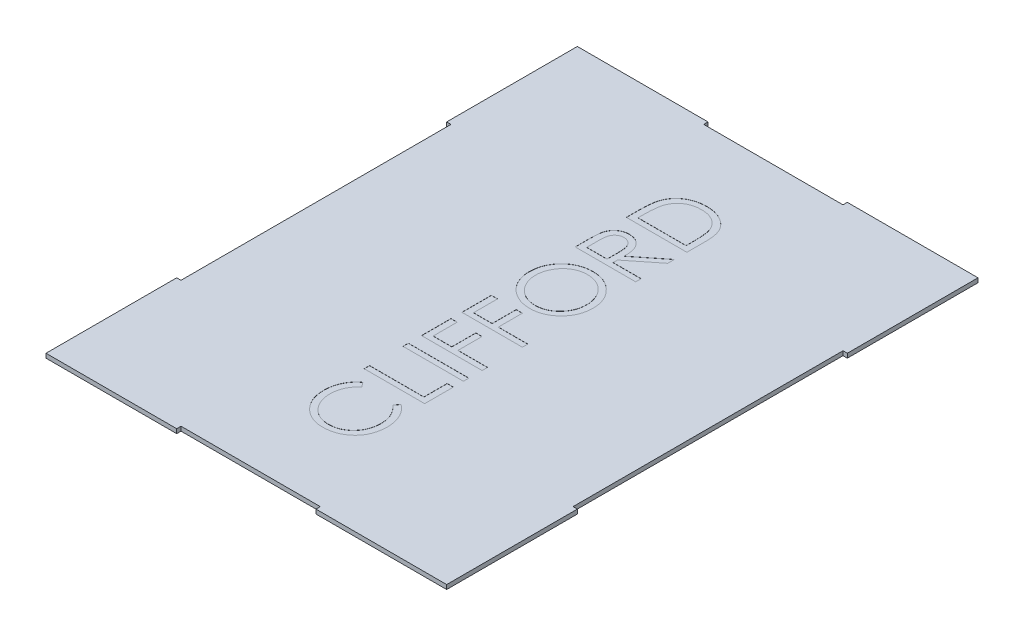
from build123d import *

# Parameters (mm, degrees)
SALIENTE_EXTRUIR1_DEPTH = 3.3
CROQUIS2_W              = 46.302083333
CROQUIS2_H              = 4.155315171
CORTAR_EXTRUIR1_DEPTH   = 0.1


with BuildPart() as part:
    # Croquis1 → Saliente-Extruir1 (new body)
    with BuildSketch(Plane(origin=(0, 0, 0), x_dir=(1, 0, 0), z_dir=(0, 1, 0))):
        Polygon((53.3, 200), (-53.3, 200), (-53.3, 203.3), (-153.3, 203.3), (-153.3, 103.3), (-150, 103.3), (-150, -103.3), (-153.3, -103.3), (-153.3, -200), (-153.3, -203.3), (-53.3, -203.3), (-53.3, -200), (53.3, -200), (53.3, -203.3), (153.3, -203.3), (153.3, -200), (153.3, -103.3), (150, -103.3), (150, 103.3), (153.3, 103.3), (153.3, 203.3), (150, 203.3), (53.3, 203.3), align=None)
    extrude(amount=SALIENTE_EXTRUIR1_DEPTH)

    # Croquis2 → Cortar-Extruir1 (cut)
    # profile 1 of 8: a face of its own
    with BuildSketch(Plane(origin=(0, 3.3, 0), x_dir=(1, 0, 0), z_dir=(0, 1, 0))):
        with BuildLine():
            Line((-12.80594785, -101.323450855), (-10.023370726, -104.959351629))
            add(Edge.make_bspline(
                [(-10.023370726, -104.959351629), (-10.332478946, -105.218723854), (-10.946527937, -105.733971403), (-11.808859078, -106.562861358), (-12.616476844, -107.426893854), (-13.374570292, -108.324866699), (-14.052670074, -109.277561062), (-14.703587169, -110.248676606), (-15.273487484, -111.273498261), (-15.969692012, -112.683434577), (-16.68034091, -114.53506359), (-17.291560308, -116.857904729), (-17.676981206, -119.286062955), (-17.719008061, -120.942259554), (-17.740384615, -121.784667969)],
                knots=[0, 0, 0, 0, 0.75789156, 1.505565099, 2.245254514, 2.979266606, 3.711207489, 4.440978832, 5.174393176, 5.91211879, 7.394186119, 8.890401545, 10.418332761, 12, 12, 12, 12], degree=3))
            add(Edge.make_bspline(
                [(-17.740384615, -121.784667969), (-17.735040528, -122.248790783), (-17.724401951, -123.172728914), (-17.584052066, -124.543911844), (-17.386789184, -125.889490751), (-17.094089592, -127.208590352), (-16.724035164, -128.49953159), (-16.28184475, -129.770753935), (-15.73475484, -131.00385271), (-15.130072049, -132.215884842), (-14.447086204, -133.377133651), (-13.702099422, -134.475871862), (-12.903495978, -135.508156436), (-12.048107772, -136.47456855), (-11.140430132, -137.376962968), (-10.170294074, -138.203984379), (-9.14807065, -138.966682421), (-8.072910959, -139.660710324), (-6.954828454, -140.28549661), (-5.787439557, -140.810844724), (-4.590732324, -141.269680213), (-3.356222947, -141.638464887), (-2.092116619, -141.928096781), (-0.793176499, -142.128334943), (0.538134693, -142.267058274), (1.440485494, -142.277648089), (1.895334619, -142.282986111)],
                knots=[0, 0, 0, 0, 1.054877232, 2.099964208, 3.13098259, 4.145888998, 5.169474743, 6.183358035, 7.203388855, 8.234598956, 9.261847606, 10.264062591, 11.251197969, 12.227332808, 13.196685059, 14.158975844, 15.123498106, 16.094582253, 17.066912473, 18.032714859, 19.002806091, 19.979168736, 20.95977404, 21.949109834, 22.966205168, 24, 24, 24, 24], degree=3))
            add(Edge.make_bspline(
                [(1.895334619, -142.282986111), (2.579681616, -142.266254155), (3.923306171, -142.23340318), (5.89163394, -141.942277734), (7.779103417, -141.496330588), (9.572934722, -140.838919835), (11.288081611, -140.012121507), (12.903744416, -138.980505171), (14.443593071, -137.781190666), (15.870333336, -136.401874561), (17.173569401, -134.888340929), (18.321212186, -133.264498957), (19.277876527, -131.53432901), (20.0739545, -129.716951429), (20.685892365, -127.79837659), (21.116688608, -125.782055823), (21.397704948, -123.672374204), (21.424608947, -122.230799853), (21.438301282, -121.497134999)],
                knots=[0, 0, 0, 0, 1.029159485, 2.020618137, 2.987588728, 3.942669054, 4.889339625, 5.846988364, 6.821327795, 7.821533711, 8.827683044, 9.822769455, 10.807800696, 11.797391277, 12.803701919, 13.832062008, 14.896664671, 16, 16, 16, 16], degree=3))
            add(Edge.make_bspline(
                [(21.438301282, -121.497134999), (21.415960133, -120.688797343), (21.371987408, -119.097795464), (20.999464008, -116.764593449), (20.395447803, -114.531036966), (19.550131539, -112.397005874), (18.451247002, -110.368516283), (17.119097998, -108.442393798), (15.541012763, -106.617012605), (14.336058879, -105.519371684), (13.721287393, -104.959351629)],
                knots=[0, 0, 0, 0, 1.028121516, 2.023589091, 2.998037872, 3.967518031, 4.937445131, 5.927275754, 6.942489185, 8, 8, 8, 8], degree=3))
            Line((13.721287393, -104.959351629), (16.476038745, -101.323450855))
            add(Edge.make_bspline(
                [(16.476038745, -101.323450855), (16.853565617, -101.616065276), (17.606811028, -102.199892513), (18.668932637, -103.145070362), (19.667064197, -104.141494722), (20.596221078, -105.19172681), (21.460249201, -106.297617722), (22.259617924, -107.45906598), (22.990084988, -108.675080178), (23.661054848, -109.936001657), (24.251821063, -111.244735954), (24.775326231, -112.589761716), (25.208730681, -113.979325863), (25.575342216, -115.401731329), (25.836752739, -116.869824464), (26.044919597, -118.366539772), (26.1684196, -119.905885986), (26.180905547, -120.943493056), (26.187232906, -121.469309228)],
                knots=[0, 0, 0, 0, 0.986911346, 1.969095443, 2.935967484, 3.900112155, 4.865124501, 5.834589912, 6.812044781, 7.795288262, 8.784678562, 9.777857908, 10.776141921, 11.791195789, 12.811324908, 13.855933174, 14.913475973, 16, 16, 16, 16], degree=3))
            add(Edge.make_bspline(
                [(26.187232906, -121.469309228), (26.183766963, -121.967303574), (26.176913489, -122.952025724), (26.065892108, -124.405894625), (25.91442163, -125.821277621), (25.686349063, -127.194129443), (25.417210398, -128.531941821), (25.056434398, -129.822587053), (24.652294382, -131.078765357), (24.177301328, -132.295429864), (23.641305997, -133.473615476), (23.035521832, -134.609522147), (22.365042998, -135.702627451), (21.644648589, -136.763678331), (20.851198866, -137.777000532), (19.995713181, -138.751375294), (19.081074913, -139.692266386), (18.421536749, -140.274385239), (18.089933477, -140.567063552)],
                knots=[0, 0, 0, 0, 1.114604814, 2.203992996, 3.262667896, 4.300477797, 5.318619304, 6.316056647, 7.298880507, 8.271930387, 9.238335007, 10.195173496, 11.151986948, 12.108099108, 13.064862484, 14.031167946, 15.010108607, 16, 16, 16, 16], degree=3))
            add(Edge.make_bspline(
                [(18.089933477, -140.567063552), (17.513907949, -141.035817009), (16.368811178, -141.967664721), (14.51311951, -143.160402597), (12.577345444, -144.17797572), (10.550276643, -145.009905325), (8.431125087, -145.648924318), (6.223299873, -146.09819621), (3.931214559, -146.388110675), (2.372354013, -146.421386819), (1.579975878, -146.438301282)],
                knots=[0, 0, 0, 0, 0.994611881, 1.977215934, 2.950189954, 3.921972279, 4.908960509, 5.911694611, 6.938501887, 8, 8, 8, 8], degree=3))
            add(Edge.make_bspline(
                [(1.579975878, -146.438301282), (0.747127691, -146.417727367), (-0.891449124, -146.377249474), (-3.296167048, -146.033346763), (-5.600044928, -145.480118939), (-7.798781966, -144.6943476), (-9.903942965, -143.698120557), (-11.899446404, -142.467455978), (-13.798054066, -141.016651076), (-15.570957547, -139.357084295), (-17.192051066, -137.537183088), (-18.618237303, -135.588277946), (-19.805125275, -133.514183439), (-20.797262007, -131.33774936), (-21.559850217, -129.042678364), (-22.09368925, -126.633867127), (-22.425967767, -124.1158419), (-22.467973122, -122.397870227), (-22.489316239, -121.524960771)],
                knots=[0, 0, 0, 0, 1.032925535, 2.032216505, 3.007276963, 3.968222605, 4.92396291, 5.891752235, 6.871517503, 7.883894988, 8.900124299, 9.891468569, 10.874487609, 11.85992873, 12.854644235, 13.869047385, 14.917252991, 16, 16, 16, 16], degree=3))
            add(Edge.make_bspline(
                [(-22.489316239, -121.524960771), (-22.482932406, -120.992958564), (-22.470296251, -119.939913772), (-22.34726415, -118.382119014), (-22.141736462, -116.865589557), (-21.863465469, -115.388730463), (-21.513039295, -113.947272028), (-21.076296033, -112.543910989), (-20.556322491, -111.18208382), (-19.962536807, -109.862232935), (-19.294828202, -108.593268055), (-18.561072499, -107.375985815), (-17.764977168, -106.215239191), (-16.898392, -105.117061247), (-15.968505216, -104.080108383), (-14.986209148, -103.088998363), (-13.926297321, -102.172581446), (-13.180081295, -101.607012513), (-12.80594785, -101.323450855)],
                knots=[0, 0, 0, 0, 1.096622143, 2.170653093, 3.219033441, 4.250379162, 5.267604342, 6.275621678, 7.278284436, 8.271072515, 9.257558938, 10.232633088, 11.19973724, 12.157384997, 13.114417402, 14.069920322, 15.032307892, 16, 16, 16, 16], degree=3))
        make_face()
    # profile 2 of 8: a face of its own
    with BuildSketch(Plane(origin=(0, 3.3, 0), x_dir=(1, 0, 0), z_dir=(0, 1, 0))):
        Polygon((-21.302083333, -91.825587607), (-21.302083333, -87.670272436), (20.251068376, -87.670272436), (20.251068376, -69.861778846), (25, -69.861778846), (25, -91.825587607), align=None)
    # profile 3 of 8: a face of its own
    with BuildSketch(Plane(origin=(0, 3.3, 0), x_dir=(1, 0, 0), z_dir=(0, 1, 0))):
        with Locations((1.848958333, -60.067107372)):
            Rectangle(CROQUIS2_W, CROQUIS2_H)
    # profile 4 of 8: a face of its own
    with BuildSketch(Plane(origin=(0, 3.3, 0), x_dir=(1, 0, 0), z_dir=(0, 1, 0))):
        Polygon((-21.302083333, -47.897970085), (-21.302083333, -25.340544872), (-16.553151709, -25.340544872), (-16.553151709, -43.742654915), (-2.306356838, -43.742654915), (-2.306356838, -25.340544872), (2.442574786, -25.340544872), (2.442574786, -43.742654915), (25, -43.742654915), (25, -47.897970085), align=None)
    # profile 5 of 8: a face of its own
    with BuildSketch(Plane(origin=(0, 3.3, 0), x_dir=(1, 0, 0), z_dir=(0, 1, 0))):
        Polygon((-21.302083333, -17.02991453), (-21.302083333, 5.527510684), (-16.553151709, 5.527510684), (-16.553151709, -12.874599359), (-2.306356838, -12.874599359), (-2.306356838, 5.527510684), (2.442574786, 5.527510684), (2.442574786, -12.874599359), (25, -12.874599359), (25, -17.02991453), align=None)
    # profile 6 of 8: a face of its own
    with BuildSketch(Plane(origin=(0, 3.3, 0), x_dir=(1, 0, 0), z_dir=(0, 1, 0))):
        with BuildLine():
            add(Edge.make_bspline(
                [(-22.489316239, 35.50514156), (-22.467966404, 36.362592273), (-22.426033565, 38.046696217), (-22.094447326, 40.519512186), (-21.548691071, 42.887344353), (-20.777966709, 45.151553961), (-19.778819418, 47.303529659), (-18.5651416, 49.349349194), (-17.129557497, 51.28288145), (-15.493147293, 53.090817146), (-13.701011053, 54.740073345), (-11.78249522, 56.187304223), (-9.7617206, 57.408180044), (-7.638581793, 58.407599876), (-5.418035739, 59.192210682), (-3.087637417, 59.733497461), (-0.662650221, 60.079293807), (0.991352051, 60.119717764), (1.830407819, 60.140224359)],
                knots=[0, 0, 0, 0, 1.065064174, 2.09187391, 3.093564831, 4.079973196, 5.057907931, 6.036227367, 7.030399151, 8.044883615, 9.061699972, 10.052012555, 11.025713132, 11.989727027, 12.962874294, 13.945865945, 14.957962116, 16, 16, 16, 16], degree=3))
            add(Edge.make_bspline(
                [(1.830407819, 60.140224359), (2.663278052, 60.119710863), (4.30496177, 60.079276385), (6.714629649, 59.733216882), (9.030706399, 59.189795434), (11.248029776, 58.417314427), (13.366856404, 57.417127682), (15.389160817, 56.194454549), (17.312801012, 54.749970352), (19.117283609, 53.107717739), (20.767967392, 51.312167456), (22.223934784, 49.401025033), (23.445342068, 47.380304294), (24.455919519, 45.270945883), (25.224179152, 43.056386444), (25.783497531, 40.752741362), (26.125861093, 38.347459622), (26.166551152, 36.708960527), (26.187232906, 35.876151843)],
                knots=[0, 0, 0, 0, 1.043748596, 2.057349401, 3.045489418, 4.02252776, 4.995289225, 5.97782527, 6.980224157, 8.006516136, 9.032559198, 10.034193337, 11.013412982, 11.987833483, 12.961212594, 13.946489799, 14.956251404, 16, 16, 16, 16], degree=3))
            add(Edge.make_bspline(
                [(26.187232906, 35.876151843), (26.166735809, 35.037100956), (26.126330575, 33.383108308), (25.779972407, 30.955066278), (25.238353076, 28.623058625), (24.464321992, 26.393754187), (23.463969044, 24.265909806), (22.244181946, 22.23536392), (20.796816641, 20.310266868), (19.154196331, 18.50657918), (17.365989341, 16.856251246), (15.449952842, 15.417455338), (13.44367753, 14.197393943), (11.3415957, 13.200399857), (9.153869323, 12.41108878), (6.86590509, 11.872597957), (4.490747044, 11.524195258), (2.873575368, 11.484046768), (2.053013989, 11.463675214)],
                knots=[0, 0, 0, 0, 1.053102029, 2.075944431, 3.073151272, 4.055350789, 5.033113405, 6.020478099, 7.024410459, 8.052272461, 9.079885166, 10.07527673, 11.055994387, 12.023226415, 12.992069828, 13.970394897, 14.97016774, 16, 16, 16, 16], degree=3))
            add(Edge.make_bspline(
                [(2.053013989, 11.463675214), (1.50224847, 11.470747996), (0.407665586, 11.484804334), (-1.217757145, 11.654027766), (-2.817039805, 11.899583604), (-4.385634637, 12.251504739), (-5.919701831, 12.7117695), (-7.429821297, 13.254853613), (-8.900689309, 13.918161984), (-10.339273762, 14.667999723), (-11.723149183, 15.504900725), (-13.031243669, 16.429298661), (-14.274533939, 17.408724889), (-15.420801594, 18.482448951), (-16.503392673, 19.615083174), (-17.505670284, 20.825001301), (-18.436672239, 22.104820576), (-19.275670501, 23.460047891), (-20.034484053, 24.857289653), (-20.685648123, 26.297638692), (-21.244528312, 27.761532919), (-21.697505895, 29.255828783), (-22.055117205, 30.776558163), (-22.298631155, 32.327040105), (-22.468286193, 33.90603939), (-22.482276064, 34.96981413), (-22.489316239, 35.50514156)],
                knots=[0, 0, 0, 0, 1.037015668, 2.060948919, 3.074880161, 4.083647147, 5.086022904, 6.090072063, 7.104153813, 8.122640571, 9.144368836, 10.147691507, 11.138137339, 12.123020368, 13.103399296, 14.087645067, 15.080126199, 16.082011238, 17.087798457, 18.072939717, 19.057185487, 20.037253025, 21.01195951, 21.997135196, 22.992090687, 24, 24, 24, 24], degree=3))
        make_face()
        with BuildLine():
            add(Edge.make_bspline(
                [(-17.740384615, 35.709197216), (-17.735046935, 35.269789674), (-17.724422604, 34.395175356), (-17.583709331, 33.095035924), (-17.384593485, 31.81160065), (-17.095407453, 30.547353152), (-16.721357885, 29.299642066), (-16.270224582, 28.067913459), (-15.724962379, 26.856390522), (-15.11174878, 25.666586788), (-14.415236228, 24.525982825), (-13.675607927, 23.431831735), (-12.865382676, 22.412593309), (-12.002082836, 21.454266067), (-11.078216295, 20.559233271), (-10.099850197, 19.727889715), (-9.062752843, 18.96091713), (-7.971192326, 18.267545699), (-6.831263072, 17.650499251), (-5.664755611, 17.098031696), (-4.457961053, 16.640057173), (-3.218410163, 16.277273117), (-1.951565367, 15.969352579), (-0.650524434, 15.776202028), (0.680227483, 15.634102293), (1.579575885, 15.624066472), (2.034463475, 15.618990385)],
                knots=[0, 0, 0, 0, 1.008406545, 2.007172654, 2.999155034, 3.989332444, 4.982025741, 5.988181096, 6.998684226, 8.030553839, 9.059268815, 10.065399129, 11.060956322, 12.046057109, 13.024974577, 14.012068307, 14.991706172, 15.984221787, 16.978487447, 17.966117052, 18.945677757, 19.938371053, 20.93015022, 21.936155317, 22.956113857, 24, 24, 24, 24], degree=3))
            add(Edge.make_bspline(
                [(2.034463475, 15.618990385), (2.703344313, 15.635894333), (4.019239847, 15.669149629), (5.947847896, 15.959079435), (7.803126395, 16.409224099), (9.574017164, 17.061848833), (11.268417082, 17.894400459), (12.879732162, 18.909944422), (14.407487084, 20.117780965), (15.840309237, 21.488970238), (17.147582147, 22.988329566), (18.296681901, 24.579665421), (19.263796305, 26.250387745), (20.072282213, 27.99086693), (20.681361858, 29.815962879), (21.115635364, 31.713973788), (21.397100367, 33.684941604), (21.424437311, 35.028041942), (21.438301282, 35.709197216)],
                knots=[0, 0, 0, 0, 1.032022337, 2.030307203, 3.003823408, 3.974715386, 4.937372378, 5.913284036, 6.909147208, 7.938749767, 8.970518239, 9.975863271, 10.963918693, 11.946286286, 12.933361397, 13.927862637, 14.949112547, 16, 16, 16, 16], degree=3))
            add(Edge.make_bspline(
                [(21.438301282, 35.709197216), (21.432015831, 36.167053882), (21.419549893, 37.075121166), (21.293815941, 38.425733444), (21.092590114, 39.752138668), (20.801435276, 41.051886093), (20.441861958, 42.326678673), (19.995848314, 43.572669904), (19.461184858, 44.78944594), (18.865320127, 45.982989944), (18.188433853, 47.126577307), (17.458776421, 48.214091523), (16.662847301, 49.23157396), (15.811141941, 50.189451569), (14.890115359, 51.078211698), (13.917695153, 51.907188249), (12.878396674, 52.660899664), (11.791306929, 53.351920549), (10.659688448, 53.976495907), (9.489974009, 54.512983184), (8.288437181, 54.97115442), (7.054195169, 55.34049234), (5.79002429, 55.63005466), (4.49411525, 55.829539689), (3.169092047, 55.969089375), (2.272897091, 55.979607226), (1.821132562, 55.984909188)],
                knots=[0, 0, 0, 0, 1.047334373, 2.07717862, 3.100662057, 4.115010574, 5.122652213, 6.129548646, 7.140165612, 8.16200981, 9.179904151, 10.178566626, 11.156366481, 12.133321541, 13.108841334, 14.082538371, 15.054589433, 16.043660176, 17.028268541, 18.009491307, 18.985652105, 19.968123554, 20.954864208, 21.950389976, 22.966808393, 24, 24, 24, 24], degree=3))
            add(Edge.make_bspline(
                [(1.821132562, 55.984909188), (1.372458704, 55.979602798), (0.482431456, 55.969076595), (-0.833352286, 55.829608441), (-2.119931231, 55.629836246), (-3.372254453, 55.341933751), (-4.59064121, 54.970853605), (-5.77394707, 54.513291997), (-6.926580761, 53.973736661), (-8.045691772, 53.354502149), (-9.119569796, 52.6584413), (-10.146170629, 51.897830546), (-11.106301326, 51.059596472), (-12.023340311, 50.167469174), (-12.878944907, 49.199999969), (-13.669809201, 48.157020021), (-14.4315669, 47.064498169), (-15.105730901, 45.897727837), (-15.731437353, 44.697898402), (-16.265260992, 43.465606263), (-16.723739894, 42.218450359), (-17.096524068, 40.951444329), (-17.383485763, 39.665187056), (-17.58388752, 38.360426554), (-17.724374275, 37.041717178), (-17.7350309, 36.154780049), (-17.740384615, 35.709197216)],
                knots=[0, 0, 0, 0, 1.029877221, 2.042951179, 3.035109885, 4.018542222, 4.991021277, 5.957494829, 6.929429462, 7.911425532, 8.892163142, 9.866273635, 10.842761649, 11.81676864, 12.802607151, 13.805177466, 14.821356543, 15.858816981, 16.897175917, 17.927346774, 18.940346092, 19.946830556, 20.957962087, 21.964146003, 22.97721996, 24, 24, 24, 24], degree=3))
        make_face(mode=Mode.SUBTRACT)
    # profile 7 of 8: a face of its own
    with BuildSketch(Plane(origin=(0, 3.3, 0), x_dir=(1, 0, 0), z_dir=(0, 1, 0))):
        with BuildLine():
            Line((-21.302083333, 69.638087607), (-21.302083333, 78.904069428))
            add(Edge.make_bspline(
                [(-21.302083333, 78.904069428), (-21.30002506, 79.522415607), (-21.296072948, 80.709708767), (-21.274036293, 82.41062599), (-21.210875546, 83.956151127), (-21.15652241, 85.345476085), (-21.05741027, 86.578575375), (-20.962680876, 87.659230159), (-20.838675155, 88.58246324), (-20.723509664, 89.141340648), (-20.671365852, 89.394385183)],
                knots=[0, 0, 0, 0, 1.410062039, 2.707475311, 3.878576406, 4.937260626, 5.877586885, 6.699081471, 7.410979367, 8, 8, 8, 8], degree=3))
            add(Edge.make_bspline(
                [(-20.671365852, 89.394385183), (-20.587667793, 89.733139218), (-20.422057182, 90.403420745), (-20.072021983, 91.368493148), (-19.666937801, 92.288095628), (-19.191211738, 93.15849158), (-18.641048703, 93.975013772), (-18.026925804, 94.747231161), (-17.350083432, 95.472637095), (-16.604420077, 96.141764449), (-15.80582318, 96.749567026), (-14.956484522, 97.282703504), (-14.059915938, 97.733194025), (-13.114720957, 98.086713454), (-12.131340684, 98.3833551), (-11.099738241, 98.582661742), (-10.023357437, 98.706810307), (-9.290973188, 98.719074965), (-8.919615134, 98.725293803)],
                knots=[0, 0, 0, 0, 1.02737844, 2.032840108, 3.019645024, 3.985760442, 4.950801802, 5.916702504, 6.889791722, 7.870143693, 8.864820395, 9.842884691, 10.820524757, 11.815201459, 12.812418953, 13.84314332, 14.906358105, 16, 16, 16, 16], degree=3))
            add(Edge.make_bspline(
                [(-8.919615134, 98.725293803), (-8.302671563, 98.705860183), (-7.098854863, 98.667940155), (-5.351799452, 98.314389304), (-3.722107477, 97.735262429), (-2.211830913, 96.937235584), (-0.850408834, 95.920977937), (0.345381564, 94.699597888), (1.346034575, 93.272414069), (2.03994147, 91.943817911), (2.484347657, 90.770202977), (2.797036988, 89.80403311), (3.03862757, 88.750105387), (3.25505848, 87.618517731), (3.418461104, 86.404561039), (3.53814001, 85.111144893), (3.612938363, 83.737346845), (3.624077386, 82.793590407), (3.629807692, 82.308088775)],
                knots=[0, 0, 0, 0, 1.260483769, 2.459530307, 3.627416485, 4.787058657, 5.939039949, 7.08810263, 8.267026773, 9.491475466, 10.141966685, 10.831826277, 11.566392101, 12.351337768, 13.187381173, 14.07005841, 15.007169909, 16, 16, 16, 16], degree=3))
            Line((3.629807692, 82.308088775), (25, 99.318910256))
            Line((25, 99.318910256), (25, 94.180417835))
            Line((25, 94.180417835), (3.629807692, 77.169596354))
            Line((3.629807692, 77.169596354), (3.629807692, 73.793402778))
            Line((3.629807692, 73.793402778), (25, 73.793402778))
            Line((25, 73.793402778), (25, 69.638087607))
            Line((25, 69.638087607), (-21.302083333, 69.638087607))
        make_face()
        with BuildLine():
            Line((-16.553151709, 73.793402778), (-1.119123932, 73.793402778))
            Line((-1.119123932, 73.793402778), (-1.054197132, 82.270987747))
            add(Edge.make_bspline(
                [(-1.054197132, 82.270987747), (-1.05402192, 82.66680498), (-1.05368231, 83.434011513), (-1.106518019, 84.543946693), (-1.166617644, 85.577413046), (-1.258567344, 86.530444237), (-1.37699729, 87.403510286), (-1.525371142, 88.196029879), (-1.697492568, 88.909769526), (-1.966656834, 89.7395005), (-2.374475381, 90.67697719), (-3.007890852, 91.673535), (-3.768986137, 92.547934524), (-4.664420888, 93.260067995), (-5.633308577, 93.856719822), (-6.68557242, 94.258242771), (-7.787078002, 94.52584077), (-8.543898122, 94.555096384), (-8.928890391, 94.569978632)],
                knots=[0, 0, 0, 0, 1.146477201, 2.22219935, 3.21835465, 4.145220026, 4.995151787, 5.769831222, 6.480173269, 7.120302478, 8.295254187, 9.430763426, 10.528629691, 11.636497428, 12.733230534, 13.811001502, 14.886462612, 16, 16, 16, 16], degree=3))
            add(Edge.make_bspline(
                [(-8.928890391, 94.569978632), (-9.301215745, 94.554029672), (-10.039028736, 94.522424653), (-11.119713503, 94.265806571), (-12.139980224, 93.827092296), (-13.101146211, 93.249961721), (-13.960000972, 92.525660386), (-14.702828592, 91.692692105), (-15.31093527, 90.751217177), (-15.715104994, 89.879031281), (-15.952456047, 89.09320924), (-16.124970231, 88.414168877), (-16.244701507, 87.643145562), (-16.358108853, 86.783645673), (-16.449915162, 85.8340289), (-16.513241904, 84.791512007), (-16.550328892, 83.662553047), (-16.552188873, 82.880091972), (-16.553151709, 82.475043403)],
                knots=[0, 0, 0, 0, 1.100823979, 2.181431445, 3.263702604, 4.376021382, 5.48638238, 6.575013887, 7.666064109, 8.791843368, 9.405226397, 10.093019944, 10.863016055, 11.711746407, 12.658404307, 13.684961631, 14.801597923, 16, 16, 16, 16], degree=3))
            Line((-16.553151709, 82.475043403), (-16.553151709, 73.793402778))
        make_face(mode=Mode.SUBTRACT)
    # profile 8 of 8: a face of its own
    with BuildSketch(Plane(origin=(0, 3.3, 0), x_dir=(1, 0, 0), z_dir=(0, 1, 0))):
        with BuildLine():
            Line((25, 108.816773504), (-21.302083333, 108.816773504))
            Line((-21.302083333, 108.816773504), (-21.302083333, 118.166232639))
            add(Edge.make_bspline(
                [(-21.302083333, 118.166232639), (-21.296228501, 118.979416129), (-21.284916996, 120.550482399), (-21.213196509, 122.820772068), (-21.086322638, 124.921348926), (-20.901517448, 126.845304458), (-20.674597107, 128.597920491), (-20.390164675, 130.174289578), (-20.054300338, 131.582562718), (-19.767949069, 132.448668859), (-19.632537059, 132.85823985)],
                knots=[0, 0, 0, 0, 1.314313732, 2.53924729, 3.670748893, 4.714932338, 5.66265055, 6.526160246, 7.303039223, 8, 8, 8, 8], degree=3))
            add(Edge.make_bspline(
                [(-19.632537059, 132.85823985), (-19.428465254, 133.393999753), (-19.024949313, 134.453370301), (-18.262604549, 135.960889122), (-17.402382625, 137.38488579), (-16.424487444, 138.714006935), (-15.34168868, 139.951587475), (-14.161721829, 141.111673577), (-12.858374438, 142.165663304), (-11.454845318, 143.129972555), (-9.969117628, 143.999657133), (-8.403624607, 144.755545289), (-6.766424806, 145.38332623), (-5.06204181, 145.904464652), (-3.286735936, 146.315183728), (-1.438437812, 146.595402945), (0.475547269, 146.780227523), (1.774313616, 146.798801949), (2.433299529, 146.808226496)],
                knots=[0, 0, 0, 0, 0.984741985, 1.947153288, 2.898543998, 3.841229145, 4.778974371, 5.722123648, 6.681464302, 7.655713756, 8.646344578, 9.637374342, 10.639946623, 11.656849581, 12.698333139, 13.76849723, 14.867749466, 16, 16, 16, 16], degree=3))
            add(Edge.make_bspline(
                [(2.433299529, 146.808226496), (3.005609658, 146.799905774), (4.133406543, 146.783508922), (5.795530966, 146.63627744), (7.408345647, 146.422277869), (8.964172045, 146.090965224), (10.476635496, 145.688760869), (11.929637751, 145.173313884), (13.33642938, 144.582763836), (14.678275874, 143.894406606), (15.948732894, 143.137677059), (17.147263237, 142.330647701), (18.247271115, 141.455015728), (19.277581721, 140.536697195), (20.210671469, 139.55354698), (21.063549331, 138.517534794), (21.821936283, 137.424634413), (22.497749642, 136.268080475), (23.102110834, 135.032426909), (23.606220576, 133.678806157), (24.042831078, 132.213630047), (24.390154755, 130.62854305), (24.670273789, 128.92919869), (24.856778122, 127.110882938), (24.983263289, 125.177032168), (24.994312771, 123.849093549), (25, 123.165596204)],
                knots=[0, 0, 0, 0, 1.106010661, 2.179509527, 3.223302912, 4.248870533, 5.252098245, 6.246278179, 7.226402005, 8.199283979, 9.158616973, 10.083547221, 10.989831858, 11.874256832, 12.749262829, 13.607058236, 14.46581075, 15.317568432, 16.194266721, 17.121067875, 18.106207572, 19.147242834, 20.255495536, 21.43354536, 22.679031616, 24, 24, 24, 24], degree=3))
            Line((25, 123.165596204), (25, 108.816773504))
        make_face()
        with BuildLine():
            Line((20.251068376, 112.972088675), (20.251068376, 118.286810981))
            add(Edge.make_bspline(
                [(20.251068376, 118.286810981), (20.247786268, 119.050509219), (20.241473572, 120.519380614), (20.186080363, 122.63152287), (20.095567232, 124.561385719), (19.968896932, 126.309243187), (19.80130171, 127.874108405), (19.614441017, 129.259251763), (19.381641408, 130.460132784), (19.170623508, 131.18680346), (19.073110727, 131.522602831)],
                knots=[0, 0, 0, 0, 1.375205317, 2.645023457, 3.804390687, 4.853969522, 5.800190428, 6.637939096, 7.370582563, 8, 8, 8, 8], degree=3))
            add(Edge.make_bspline(
                [(19.073110727, 131.522602831), (18.924262016, 131.945253082), (18.630119841, 132.78045859), (18.093575381, 133.982738979), (17.458020312, 135.10400586), (16.751547319, 136.163786175), (15.949271448, 137.147097848), (15.068516889, 138.065401026), (14.105259684, 138.917571435), (13.061061793, 139.690483345), (11.947246288, 140.390563654), (10.761843296, 140.991553234), (9.521517798, 141.514936425), (8.216228651, 141.92936113), (6.855542932, 142.256116851), (5.432404897, 142.485154347), (3.948073866, 142.627344284), (2.937579842, 142.644296056), (2.424024272, 142.652911325)],
                knots=[0, 0, 0, 0, 0.998590647, 1.973329978, 2.929871262, 3.868367705, 4.809062953, 5.754642869, 6.701828697, 7.672172887, 8.647399344, 9.630604387, 10.631475358, 11.644913558, 12.679592956, 13.747988925, 14.855477812, 16, 16, 16, 16], degree=3))
            add(Edge.make_bspline(
                [(2.424024272, 142.652911325), (1.882508439, 142.646120961), (0.818695792, 142.63278123), (-0.742222781, 142.465110665), (-2.24347722, 142.220085921), (-3.68516793, 141.865760074), (-5.070107589, 141.414236989), (-6.390636526, 140.850745375), (-7.660700937, 140.206926557), (-8.850986817, 139.440913664), (-9.97669774, 138.60197821), (-11.007976311, 137.670937514), (-11.947171742, 136.662583463), (-12.808910566, 135.5879141), (-13.558523778, 134.416642058), (-14.22906633, 133.176358857), (-14.798130725, 131.848869249), (-15.100799014, 130.92530546), (-15.254615718, 130.455948267)],
                knots=[0, 0, 0, 0, 1.122418816, 2.205001699, 3.251619955, 4.274784885, 5.280384055, 6.268708349, 7.249350384, 8.229342522, 9.199999885, 10.157847722, 11.105861043, 12.055065948, 13.010012805, 13.98527497, 14.976112212, 16, 16, 16, 16], degree=3))
            add(Edge.make_bspline(
                [(-15.254615718, 130.455948267), (-15.361989296, 130.06765706), (-15.59029498, 129.242043418), (-15.839338971, 127.894792175), (-16.059002656, 126.378529261), (-16.244978802, 124.686522798), (-16.378425657, 122.820701516), (-16.47858784, 120.779630436), (-16.546144332, 118.562427333), (-16.550757438, 117.025429229), (-16.553151709, 116.22770391)],
                knots=[0, 0, 0, 0, 0.674548936, 1.434276114, 2.292660221, 3.240891867, 4.284742987, 5.42552168, 6.663806718, 8, 8, 8, 8], degree=3))
            Line((-16.553151709, 116.22770391), (-16.553151709, 112.972088675))
            Line((-16.553151709, 112.972088675), (20.251068376, 112.972088675))
        make_face(mode=Mode.SUBTRACT)
    extrude(amount=-CORTAR_EXTRUIR1_DEPTH, mode=Mode.SUBTRACT)


solid = part.part
